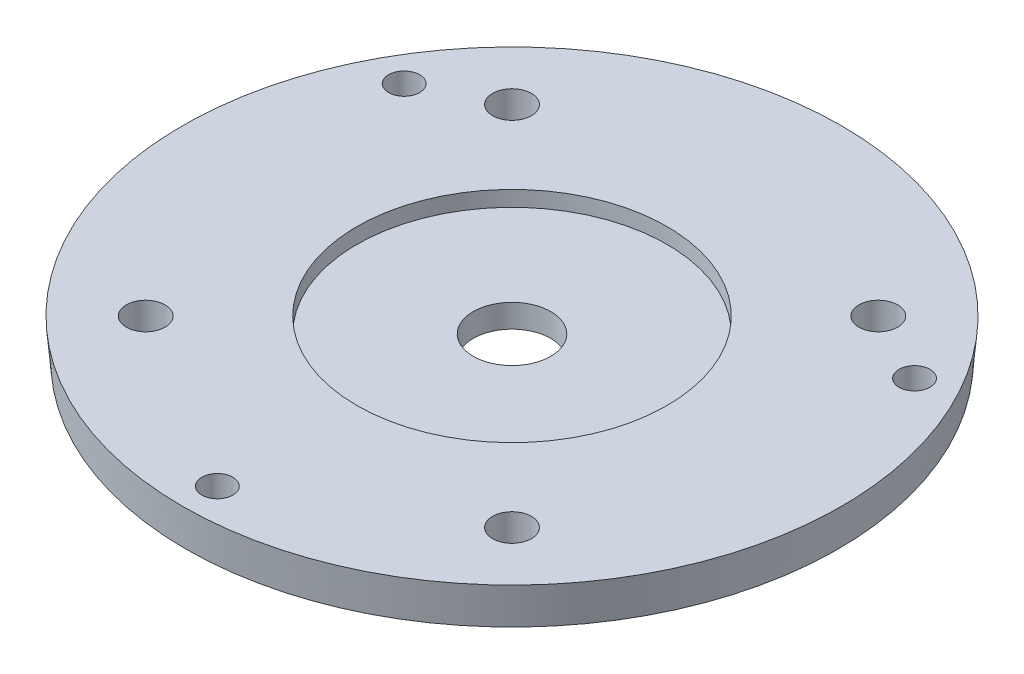
from build123d import *

# Parameters (mm, degrees)
SKETCH1_R           = 42.5
BOSS_EXTRUDE1_DEPTH = 5
BOSS_EXTRUDE1_DRAFT = -5
SKETCH2_R           = 2.5
SKETCH2_R_2         = 5
CUT_EXTRUDE2_DEPTH  = 61.311690409
SKETCH3_R           = 20
CUT_EXTRUDE3_DEPTH  = 2
SKETCH5_R           = 2
CUT_EXTRUDE4_DEPTH  = 5


with BuildPart() as part:
    # Sketch1 → Boss-Extrude1 (with draft: the straight prism first)
    with BuildSketch(Plane(origin=(0, 0, 0), x_dir=(1, 0, 0), z_dir=(0, 1, 0))):
        Circle(SKETCH1_R)
    extrude(amount=-BOSS_EXTRUDE1_DEPTH)
    # Boss-Extrude1: the draft: its side faces are tilted about the plane it starts from
    boss_extrude1_sides = [part.faces().sort_by_distance(p)[0] for p in [
        (-42.5, -2.5, 0),
    ]]
    draft(boss_extrude1_sides, Plane(origin=(0, 0, 0), x_dir=(1, 0, 0), z_dir=(0, 1, 0)), BOSS_EXTRUDE1_DRAFT)

    # Sketch2 → Cut-Extrude2 (cut, through all)
    with BuildSketch(Plane(origin=(0, 0, 0), x_dir=(1, 0, 0), z_dir=(0, 1, 0))):
        with Locations(Location((23.62, 23.62, 0), (0, 0, 270))):
            Circle(SKETCH2_R)
        with Locations(Location((23.62, -23.62, 0), (0, 0, 270))):
            Circle(SKETCH2_R)
        with Locations(Location((-23.62, -23.62, 0), (0, 0, 270))):
            Circle(SKETCH2_R)
        with Locations(Location((-23.62, 23.62, 0), (0, 0, 270))):
            Circle(SKETCH2_R)
        with Locations(Location((0, 0, 0), (0, 0, 270))):
            Circle(SKETCH2_R_2)
    extrude(amount=-CUT_EXTRUDE2_DEPTH, mode=Mode.SUBTRACT)

    # Sketch3 → Cut-Extrude3 (cut)
    with BuildSketch(Plane(origin=(0, 0, 0), x_dir=(1, 0, 0), z_dir=(0, 1, 0))):
        with Locations(Location((0, 0, 0), (0, 0, 270))):
            Circle(SKETCH3_R)
    extrude(amount=-CUT_EXTRUDE3_DEPTH, mode=Mode.SUBTRACT)

    # Sketch5 → Cut-Extrude4 (cut)
    with BuildSketch(Plane(origin=(0, 0, 0), x_dir=(1, 0, 0), z_dir=(0, 1, 0))):
        with Locations(Location((0, -38, 0), (0, 0, 270))):
            Circle(SKETCH5_R)
        with Locations(Location((-32.908965344, 19, 0), (0, 0, 270))):
            Circle(SKETCH5_R)
        with Locations(Location((32.908965344, 19, 0), (0, 0, 270))):
            Circle(SKETCH5_R)
    extrude(amount=-CUT_EXTRUDE4_DEPTH, mode=Mode.SUBTRACT)


solid = part.part
